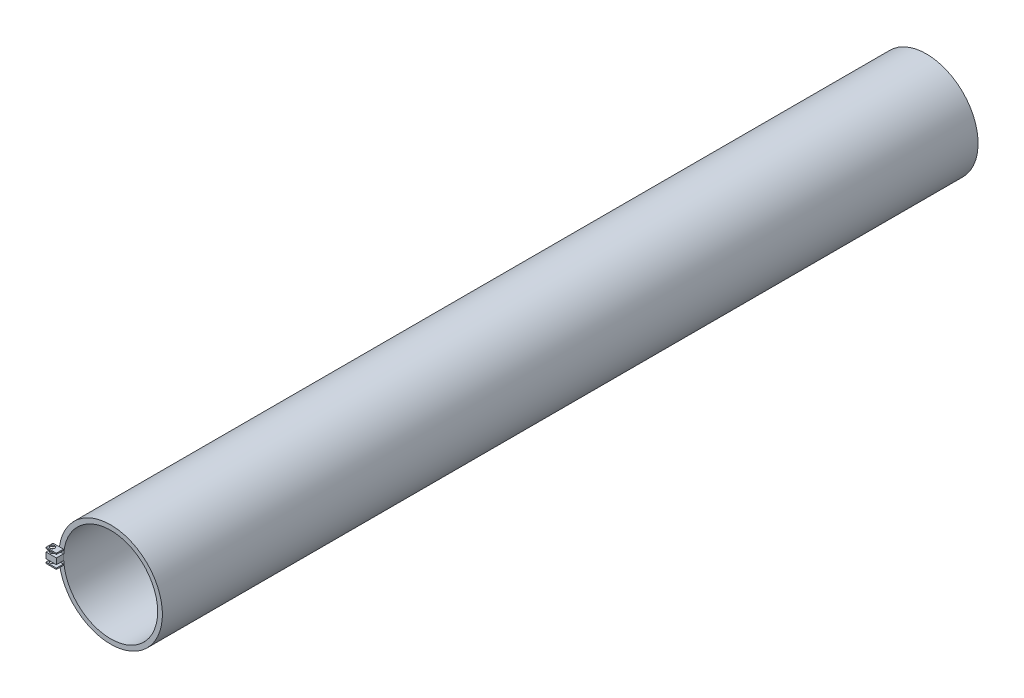
from build123d import *

# Parameters (mm, degrees)
SKETCH1_R               = 22
SKETCH1_R_2             = 20
BOSS_EXTRUDE1_DEPTH     = 350
BOSS_EXTRUDE2_DEPTH     = 3
CUT_EXTRUDE1_DEPTH      = 352.746002109
CUT_EXTRUDE1_DEPTH_BACK = 352.746002109
SKETCH3_R               = 1
SKETCH4_W               = 2.837375188
SKETCH4_H               = 2.5
SKETCH4_W_2             = 2.705505282
SKETCH4_H_2             = 0.5
BOSS_EXTRUDE3_DEPTH     = 3
CUT_EXTRUDE2_DEPTH      = 352.746002109
CUT_EXTRUDE2_DEPTH_BACK = 352.746002109
SKETCH5_R               = 1
CUT_EXTRUDE3_START      = -3
SKETCH6_R               = 22
CUT_EXTRUDE3_DEPTH      = 3
SKETCH7_W               = 3
SKETCH7_H               = 6
BOSS_EXTRUDE4_DEPTH     = 4.4
CUT_EXTRUDE4_DEPTH      = 352.746002109
CUT_EXTRUDE4_DEPTH_BACK = 352.746002109
SKETCH8_R               = 1
SKETCH9_W               = 3
SKETCH9_H               = 1.25
CUT_EXTRUDE5_DEPTH      = 4.4


with BuildPart() as part:
    # Sketch1 → Boss-Extrude1 (new body)
    with BuildSketch(Plane.XY):
        Circle(SKETCH1_R)
        Circle(SKETCH1_R_2, mode=Mode.SUBTRACT)
    extrude(amount=BOSS_EXTRUDE1_DEPTH)

    # Sketch2 → Boss-Extrude2 (add)
    with BuildSketch(Plane(origin=(0, 0, 0), x_dir=(-1, 0, 0), z_dir=(0, 0, -1))):
        with BuildLine():
            Line((24.5, 3), (21.794494718, 3))
            ThreePointArc((21.794494718, 3), (21.827425588, 2.750180393), (21.857492994, 2.5))
            Line((21.857492994, 2.5), (24.5, 2.5))
            Line((24.5, 2.5), (24.5, 3))
        make_face()
        with BuildLine():
            Line((24.5, 1.25), (21.96445993, 1.25))
            ThreePointArc((21.96445993, 1.25), (21.991113188, 0.625252568), (22, 0))
            ThreePointArc((22, 0), (21.991113188, -0.625252568), (21.96445993, -1.25))
            Line((21.96445993, -1.25), (24.5, -1.25))
            Line((24.5, -1.25), (24.5, 1.25))
        make_face()
        with BuildLine():
            ThreePointArc((21.857492994, -2.5), (21.827425588, -2.750180393), (21.794494718, -3))
            Line((21.794494718, -3), (24.5, -3))
            Line((24.5, -3), (24.5, -2.5))
            Line((24.5, -2.5), (21.857492994, -2.5))
        make_face()
    extrude(amount=-BOSS_EXTRUDE2_DEPTH)

    # Sketch3 → Cut-Extrude1 (cut, two sides: drawn at the far end of the back side and taken through both)
    with BuildSketch(Plane(origin=(0, 3, 0), x_dir=(1, 0, 0), z_dir=(0, 1, 0)).offset(-CUT_EXTRUDE1_DEPTH_BACK)):
        with Locations(Location((-23.147247359, -1.5, 0), (0, 0, 180))):
            Circle(SKETCH3_R)
    extrude(amount=CUT_EXTRUDE1_DEPTH + CUT_EXTRUDE1_DEPTH_BACK, mode=Mode.SUBTRACT)

    # Sketch4 → Boss-Extrude3 (add)
    with BuildSketch(Plane.XY.offset(350)):
        with Locations((-23.081312406, 0)):
            Rectangle(SKETCH4_W, SKETCH4_H)
        with Locations((-23.147247359, 2.75)):
            Rectangle(SKETCH4_W_2, SKETCH4_H_2)
        with Locations((-23.147247359, -2.75)):
            Rectangle(SKETCH4_W_2, SKETCH4_H_2)
    extrude(amount=-BOSS_EXTRUDE3_DEPTH)

    # Sketch5 → Cut-Extrude2 (cut, two sides: drawn at the far end of the back side and taken through both)
    with BuildSketch(Plane(origin=(0, 3, 0), x_dir=(1, 0, 0), z_dir=(0, 1, 0)).offset(-CUT_EXTRUDE2_DEPTH_BACK)):
        with Locations(Location((-23.147247359, -348.5, 0), (0, 0, 270))):
            Circle(SKETCH5_R)
    extrude(amount=CUT_EXTRUDE2_DEPTH + CUT_EXTRUDE2_DEPTH_BACK, mode=Mode.SUBTRACT)

    # Sketch6 → Cut-Extrude3 (cut)
    with BuildSketch(Plane.XY.offset(350).offset(CUT_EXTRUDE3_START)):
        with Locations(Location((0, 0, 0), (0, 0, 180))):
            Circle(SKETCH6_R)
    extrude(amount=CUT_EXTRUDE3_DEPTH, mode=Mode.SUBTRACT)


with BuildPart() as cut_extrude3_piece_1:
    # of the separate pieces the step leaves, piece 1, a body of its own (cut_extrude3_pieces)
    add(part.part.solids().sort_by_distance((22, 0, 0))[0])



with BuildPart() as cut_extrude3_piece_2:
    # of the separate pieces the step leaves, piece 2, a body of its own (cut_extrude3_pieces)
    add(part.part.solids().sort_by_distance((-24.5, 1.25, 347))[0])


with BuildPart() as cut_extrude3_piece_3:
    # of the separate pieces the step leaves, piece 3, a body of its own (cut_extrude3_pieces)
    add(part.part.solids().sort_by_distance((-24.5, -2.5, 347))[0])


with BuildPart() as cut_extrude3_piece_4:
    # of the separate pieces the step leaves, piece 4, a body of its own (cut_extrude3_pieces)
    add(part.part.solids().sort_by_distance((-24.5, 2.5, 347))[0])


with BuildPart() as cut_extrude3_piece_1_1:
    add(cut_extrude3_piece_1.part)

    add(cut_extrude3_piece_2.part)  # Boss-Extrude4 merges Cut-Extrude3 piece 2

    add(cut_extrude3_piece_3.part)  # Boss-Extrude4 merges Cut-Extrude3 piece 3

    add(cut_extrude3_piece_4.part)  # Boss-Extrude4 merges Cut-Extrude3 piece 4
    # Sketch7 → Boss-Extrude4 (add)
    with BuildSketch(Plane.ZY.offset(24.5)):
        with Locations((348.5, 0)):
            Rectangle(SKETCH7_W, SKETCH7_H)
    extrude(amount=-BOSS_EXTRUDE4_DEPTH)

    # Sketch8 → Cut-Extrude4 (cut, two sides: drawn at the far end of the back side and taken through both)
    with BuildSketch(Plane(origin=(0, 3, 0), x_dir=(1, 0, 0), z_dir=(0, 1, 0)).offset(-CUT_EXTRUDE4_DEPTH_BACK)):
        with Locations(Location((-23.25, -348.5, 0), (0, 0, 270))):
            Circle(SKETCH8_R)
    extrude(amount=CUT_EXTRUDE4_DEPTH + CUT_EXTRUDE4_DEPTH_BACK, mode=Mode.SUBTRACT)

    # Sketch9 → Cut-Extrude5 (cut)
    with BuildSketch(Plane.ZY.offset(24.5)):
        with Locations((348.5, 1.875)):
            Rectangle(SKETCH9_W, SKETCH9_H)
        with Locations((348.5, -1.875)):
            Rectangle(SKETCH9_W, SKETCH9_H)
    extrude(amount=-CUT_EXTRUDE5_DEPTH, mode=Mode.SUBTRACT)


solid = cut_extrude3_piece_1_1.part
